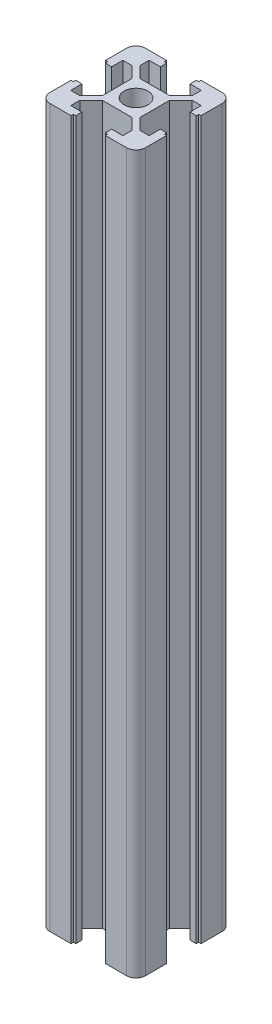
from build123d import *

# Parameters (mm, degrees)
SKETCH_1_R      = 2.5
EXTRUDE_1_DEPTH = 150


with BuildPart() as part:
    # 草图1 → 凸台-拉伸1 (new body)
    with BuildSketch(Plane(origin=(0, 0, 0), x_dir=(1, 0, 0), z_dir=(0, 1, 0))):
        with BuildLine():
            Line((-3.948528137, -3.1), (-6.298528137, -5.45))
            Line((-6.298528137, -5.45), (-8.2, -5.45))
            Line((-8.2, -5.45), (-8.2, -3.1))
            Line((-8.2, -3.1), (-9.5, -3.1))
            Line((-9.5, -3.1), (-9.5, -3.6))
            Line((-9.5, -3.6), (-10, -3.6))
            Line((-10, -3.6), (-10, -8))
            ThreePointArc((-10, -8), (-9.414213562, -9.414213562), (-8, -10))
            Line((-8, -10), (-3.6, -10))
            Line((-3.6, -10), (-3.6, -9.5))
            Line((-3.6, -9.5), (-3.1, -9.5))
            Line((-3.1, -9.5), (-3.1, -8.2))
            Line((-3.1, -8.2), (-5.45, -8.2))
            Line((-5.45, -8.2), (-5.45, -6.298528137))
            Line((-5.45, -6.298528137), (-3.1, -3.948528137))
            Line((-3.1, -3.948528137), (0, -3.948528137))
            Line((0, -3.948528137), (3.1, -3.948528137))
            Line((3.1, -3.948528137), (5.45, -6.298528137))
            Line((5.45, -6.298528137), (5.45, -8.2))
            Line((5.45, -8.2), (3.1, -8.2))
            Line((3.1, -8.2), (3.1, -9.5))
            Line((3.1, -9.5), (3.6, -9.5))
            Line((3.6, -9.5), (3.6, -10))
            Line((3.6, -10), (8, -10))
            ThreePointArc((8, -10), (9.414213562, -9.414213562), (10, -8))
            Line((10, -8), (10, -3.6))
            Line((10, -3.6), (9.5, -3.6))
            Line((9.5, -3.6), (9.5, -3.1))
            Line((9.5, -3.1), (8.2, -3.1))
            Line((8.2, -3.1), (8.2, -5.45))
            Line((8.2, -5.45), (6.298528137, -5.45))
            Line((6.298528137, -5.45), (3.948528137, -3.1))
            Line((3.948528137, -3.1), (3.948528137, 0))
            Line((3.948528137, 0), (3.948528137, 3.1))
            Line((3.948528137, 3.1), (6.298528137, 5.45))
            Line((6.298528137, 5.45), (8.2, 5.45))
            Line((8.2, 5.45), (8.2, 3.1))
            Line((8.2, 3.1), (9.5, 3.1))
            Line((9.5, 3.1), (9.5, 3.6))
            Line((9.5, 3.6), (10, 3.6))
            Line((10, 3.6), (10, 8))
            ThreePointArc((10, 8), (9.414213562, 9.414213562), (8, 10))
            Line((8, 10), (3.6, 10))
            Line((3.6, 10), (3.6, 9.5))
            Line((3.6, 9.5), (3.1, 9.5))
            Line((3.1, 9.5), (3.1, 8.2))
            Line((3.1, 8.2), (5.45, 8.2))
            Line((5.45, 8.2), (5.45, 6.298528137))
            Line((5.45, 6.298528137), (3.1, 3.948528137))
            Line((3.1, 3.948528137), (0, 3.948528137))
            Line((0, 3.948528137), (-3.1, 3.948528137))
            Line((-3.1, 3.948528137), (-5.45, 6.298528137))
            Line((-5.45, 6.298528137), (-5.45, 8.2))
            Line((-5.45, 8.2), (-3.1, 8.2))
            Line((-3.1, 8.2), (-3.1, 9.5))
            Line((-3.1, 9.5), (-3.6, 9.5))
            Line((-3.6, 9.5), (-3.6, 10))
            Line((-3.6, 10), (-8, 10))
            ThreePointArc((-8, 10), (-9.414213562, 9.414213562), (-10, 8))
            Line((-10, 8), (-10, 3.6))
            Line((-10, 3.6), (-9.5, 3.6))
            Line((-9.5, 3.6), (-9.5, 3.1))
            Line((-9.5, 3.1), (-8.2, 3.1))
            Line((-8.2, 3.1), (-8.2, 5.45))
            Line((-8.2, 5.45), (-6.298528137, 5.45))
            Line((-6.298528137, 5.45), (-3.948528137, 3.1))
            Line((-3.948528137, 3.1), (-3.948528137, 0))
            Line((-3.948528137, 0), (-3.948528137, -3.1))
        make_face()
        with Locations(Location((0, 0, 0), (0, 0, 270))):
            Circle(SKETCH_1_R, mode=Mode.SUBTRACT)
    extrude(amount=EXTRUDE_1_DEPTH)


solid = part.part
